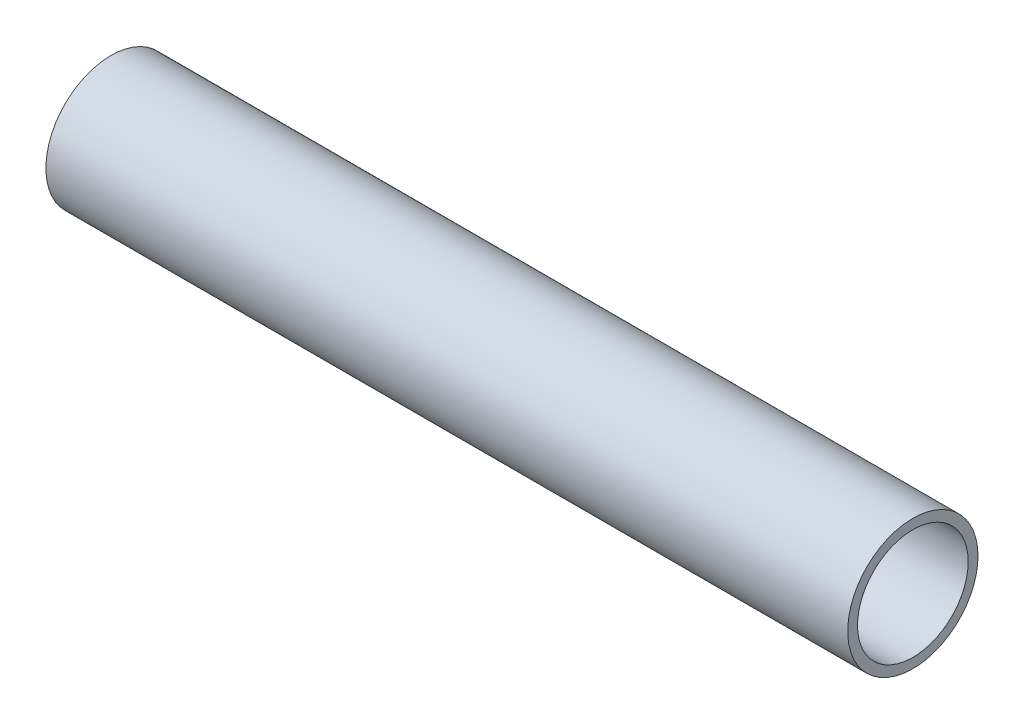
from build123d import *

# Parameters (mm, degrees)
SKETCH1_R           = 20.6375
SKETCH1_R_2         = 17.526
BOSS_EXTRUDE1_DEPTH = 254


with BuildPart() as part:
    # Sketch1 → Boss-Extrude1 (new body)
    with BuildSketch(Plane(origin=(0, 0, 0), x_dir=(0, 0, -1), z_dir=(1, 0, 0))):
        Circle(SKETCH1_R)
        Circle(SKETCH1_R_2, mode=Mode.SUBTRACT)
    extrude(amount=BOSS_EXTRUDE1_DEPTH)


solid = part.part
